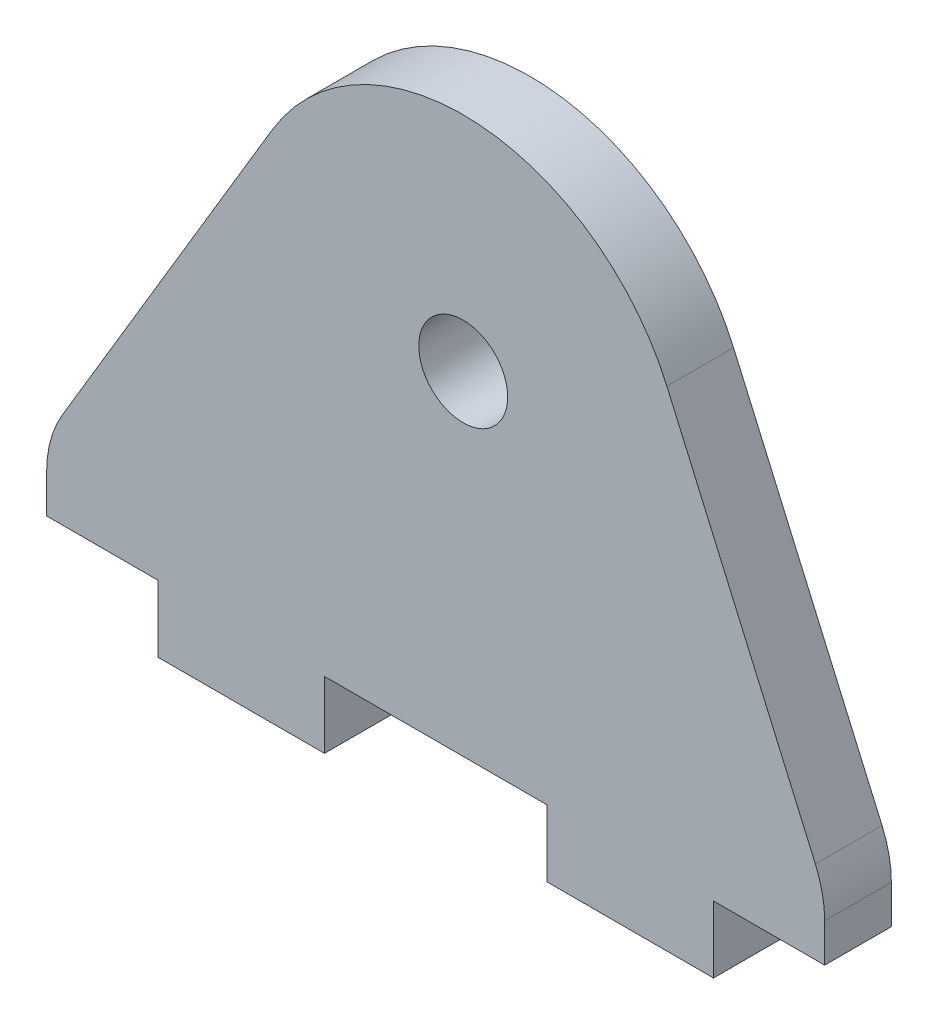
from build123d import *

# Parameters (mm, degrees)
ESQUISSE1_R        = 4
BOSS_EXTRU_1_DEPTH = 6


with BuildPart() as part:
    # Esquisse1 → Boss.-Extru.1 (new body)
    with BuildSketch(Plane.XY):
        with BuildLine():
            Line((-13.404461185, 2.593779068), (1.595538815, 2.593779068))
            Line((1.595538815, 2.593779068), (1.595538815, 8.593779068))
            Line((1.595538815, 8.593779068), (21.595538815, 8.593779068))
            Line((21.595538815, 8.593779068), (21.595538815, 2.593779068))
            Line((21.595538815, 2.593779068), (36.595538815, 2.593779068))
            Line((36.595538815, 2.593779068), (36.595538815, 8.593779068))
            Line((36.595538815, 8.593779068), (46.595538815, 8.593779068))
            Line((46.595538815, 8.593779068), (46.595538815, 12.048496629))
            ThreePointArc((46.595538815, 12.048496629), (46.383875367, 14.095071218), (45.757845305, 16.0550088))
            Line((45.757845305, 16.0550088), (32.398093908, 46.60680341))
            ThreePointArc((32.398093908, 46.60680341), (15.328741232, 58.554348238), (-3.102903491, 48.839354618))
            Line((-3.102903491, 48.839354618), (-21.992653394, 17.171284404))
            ThreePointArc((-21.992653394, 17.171284404), (-23.045050433, 14.705381827), (-23.404461185, 12.048496629))
            Line((-23.404461185, 12.048496629), (-23.404461185, 8.593779068))
            Line((-23.404461185, 8.593779068), (-13.404461185, 8.593779068))
            Line((-13.404461185, 8.593779068), (-13.404461185, 2.593779068))
        make_face()
        with Locations((14.073480927, 38.593779068)):
            Circle(ESQUISSE1_R, mode=Mode.SUBTRACT)
    extrude(amount=BOSS_EXTRU_1_DEPTH)


solid = part.part
